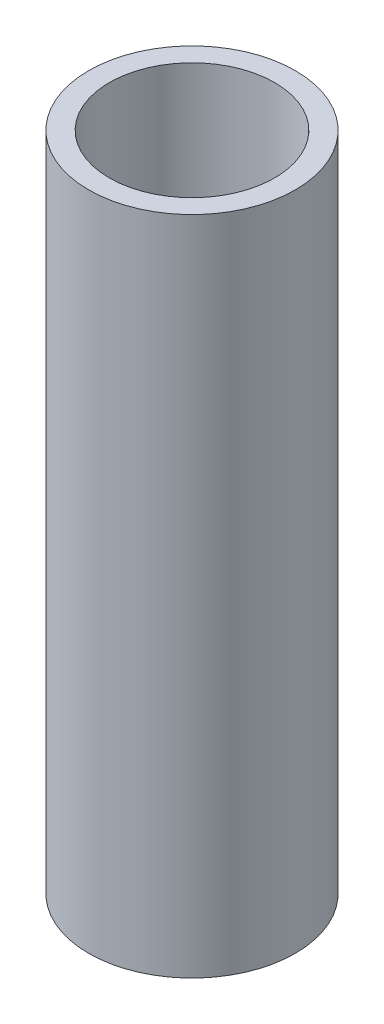
from build123d import *

# Parameters (mm, degrees)
SKETCH2_R           = 20
SKETCH2_R_2         = 13.5
BOSS_EXTRUDE1_DEPTH = 128
SKETCH3_R           = 16
CUT_EXTRUDE1_DEPTH  = 28


with BuildPart() as part:
    # Sketch2 → Boss-Extrude1 (new body)
    with BuildSketch(Plane(origin=(0, 0, 0), x_dir=(1, 0, 0), z_dir=(0, 1, 0))):
        with Locations(Location((0, 0, 0), (0, 0, 270))):
            Circle(SKETCH2_R)
        with Locations(Location((0, 0, 0), (0, 0, 270))):
            Circle(SKETCH2_R_2, mode=Mode.SUBTRACT)
    extrude(amount=BOSS_EXTRUDE1_DEPTH)

    # Sketch3 → Cut-Extrude1 (cut)
    with BuildSketch(Plane(origin=(0, 128, 0), x_dir=(1, 0, 0), z_dir=(0, 1, 0))):
        with Locations(Location((0, 0, 0), (0, 0, 270))):
            Circle(SKETCH3_R)
    extrude(amount=-CUT_EXTRUDE1_DEPTH, mode=Mode.SUBTRACT)


solid = part.part
